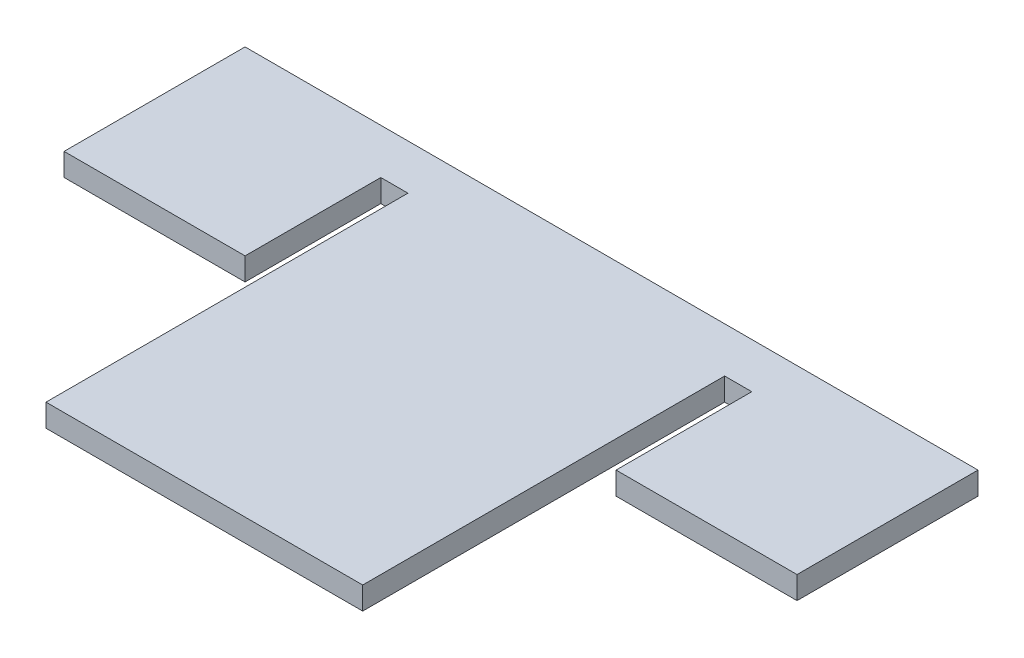
from build123d import *

# Parameters (mm, degrees)
BOSS_EXTRUDE1_DEPTH = 3.175


with BuildPart() as part:
    # Sketch1 → Boss-Extrude1 (new body)
    with BuildSketch(Plane(origin=(0, 0, 0), x_dir=(1, 0, 0), z_dir=(0, 1, 0))):
        Polygon((-29.21, 57.15), (73.66, 57.15), (73.66, 31.75), (48.26, 31.75), (48.26, 50.8), (44.45, 50.8), (44.45, 0), (0, 0), (0, 50.8), (-3.81, 50.8), (-3.81, 31.75), (-29.21, 31.75), align=None)
    extrude(amount=BOSS_EXTRUDE1_DEPTH)


solid = part.part
